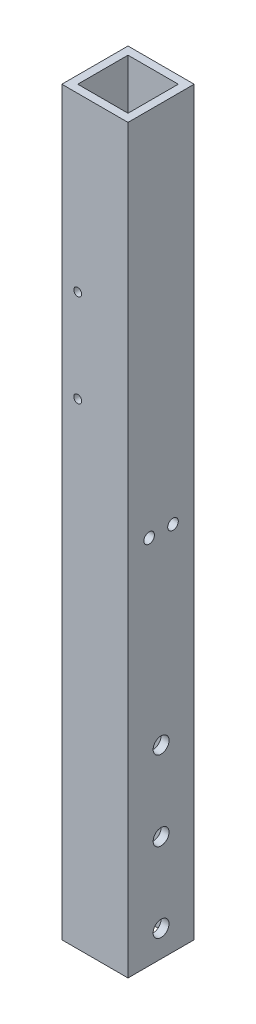
from build123d import *

# Parameters (mm, degrees)
SKETCH_1_W               = 25
SKETCH_1_H               = 25
SKETCH_1_W_2             = 19
SKETCH_1_H_2             = 19
EXTRUDE_1_DEPTH          = 280
SKETCH_2_R               = 3
SKETCH_2_R_2             = 2
CUT_EXTRUDE_1_DEPTH      = 283.223315833
CUT_EXTRUDE_2_DEPTH      = 283.223315833
CUT_EXTRUDE_2_DEPTH_BACK = 283.223315833
SKETCH_3_R               = 1.5


with BuildPart() as part:
    # 草图1 → 凸台-拉伸1 (new body)
    with BuildSketch(Plane(origin=(0, 0, 0), x_dir=(1, 0, 0), z_dir=(0, 1, 0))):
        with Locations((12.5, 12.5)):
            Rectangle(SKETCH_1_W, SKETCH_1_H)
        with Locations((12.5, 12.5)):
            Rectangle(SKETCH_1_W_2, SKETCH_1_H_2, mode=Mode.SUBTRACT)
    extrude(amount=EXTRUDE_1_DEPTH)

    # 草图2 → 切除-拉伸1 (cut, through all)
    with BuildSketch(Plane(origin=(0, 0, 0), x_dir=(0, 0, -1), z_dir=(1, 0, 0))):
        with Locations(Location((12.5, 10, 0), (0, 0, 180))):
            Circle(SKETCH_2_R)
        with Locations(Location((12.5, 40, 0), (0, 0, 180))):
            Circle(SKETCH_2_R)
        with Locations(Location((12.5, 70, 0), (0, 0, 180))):
            Circle(SKETCH_2_R)
        with Locations(Location((17, 140, 0), (0, 0, 180))):
            Circle(SKETCH_2_R_2)
        with Locations(Location((8, 140, 0), (0, 0, 180))):
            Circle(SKETCH_2_R_2)
    extrude(amount=CUT_EXTRUDE_1_DEPTH, mode=Mode.SUBTRACT)

    # 草图3 → 切除-拉伸2 (cut, two sides: drawn at the far end of the back side and taken through both)
    with BuildSketch(Plane.XY.offset(-CUT_EXTRUDE_2_DEPTH_BACK)):
        with Locations((6, 180)):
            Circle(SKETCH_3_R)
        with Locations((6, 215)):
            Circle(SKETCH_3_R)
    extrude(amount=CUT_EXTRUDE_2_DEPTH + CUT_EXTRUDE_2_DEPTH_BACK, mode=Mode.SUBTRACT)


solid = part.part
